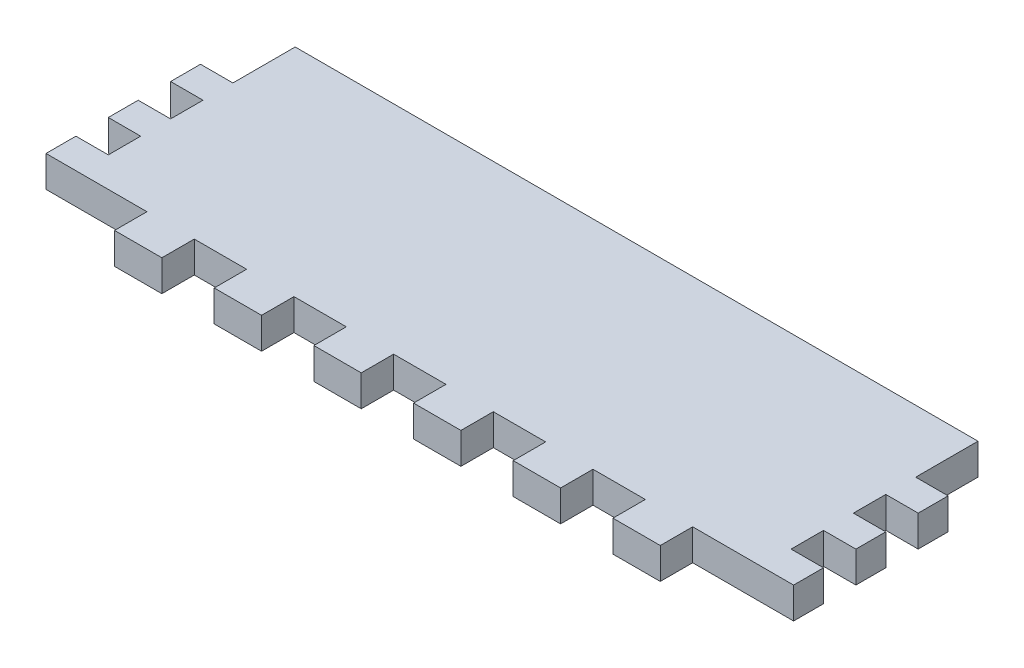
from build123d import *

# Parameters (mm, degrees)
SKETCH1_W           = 76.2
SKETCH1_H           = 25.4
BOSS_EXTRUDE1_DEPTH = 3.175
SKETCH3_W           = 10.287
SKETCH3_H           = 3.302
SKETCH3_W_2         = 5.334
SKETCH3_W_3         = 3.302
CUT_EXTRUDE1_DEPTH  = 41.286233691


with BuildPart() as part:
    # Sketch1 → Boss-Extrude1 (new body)
    with BuildSketch(Plane(origin=(0, 0, 0), x_dir=(1, 0, 0), z_dir=(0, 1, 0))):
        Rectangle(SKETCH1_W, SKETCH1_H)
    extrude(amount=BOSS_EXTRUDE1_DEPTH)

    # Sketch3 → Cut-Extrude1 (cut, through all)
    with BuildSketch(Plane(origin=(0, 3.175, 0), x_dir=(1, 0, 0), z_dir=(0, 1, 0))):
        with Locations((32.9565, -11.049)):
            Rectangle(SKETCH3_W, SKETCH3_H)
        with Locations((20.32, -11.049)):
            Rectangle(SKETCH3_W_2, SKETCH3_H)
        with Locations((10.16, -11.049)):
            Rectangle(SKETCH3_W_2, SKETCH3_H)
        with Locations((0, -11.049)):
            Rectangle(SKETCH3_W_2, SKETCH3_H)
        with Locations((-10.16, -11.049)):
            Rectangle(SKETCH3_W_2, SKETCH3_H)
        with Locations((-20.32, -11.049)):
            Rectangle(SKETCH3_W_2, SKETCH3_H)
        with Locations((-32.9565, -11.049)):
            Rectangle(SKETCH3_W, SKETCH3_H)
        with Locations((36.449, -4.699)):
            Rectangle(SKETCH3_W_3, SKETCH3_H)
        with Locations((36.449, 1.651)):
            Rectangle(SKETCH3_W_3, SKETCH3_H)
        Polygon((38.1, 6.35), (34.798, 6.35), (34.798, 9.652), (34.798, 12.7), (38.1, 12.7), (38.1, 9.652), align=None)
        Polygon((-34.798, 12.7), (-34.798, 9.652), (-34.798, 6.35), (-38.1, 6.35), (-38.1, 9.652), (-38.1, 12.7), align=None)
        with Locations((-36.449, 1.651)):
            Rectangle(SKETCH3_W_3, SKETCH3_H)
        with Locations((-36.449, -4.699)):
            Rectangle(SKETCH3_W_3, SKETCH3_H)
    extrude(amount=-CUT_EXTRUDE1_DEPTH, mode=Mode.SUBTRACT)


solid = part.part
